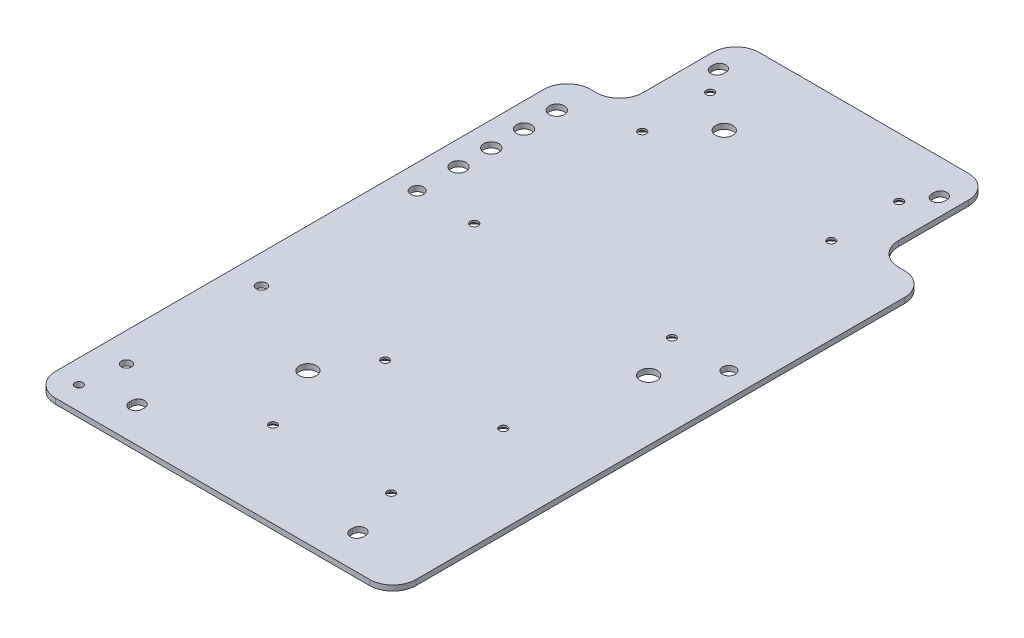
from build123d import *

# Parameters (mm, degrees)
SKETCH1_W                            = 155
SKETCH1_H                            = 280
BOSS_EXTRUDE1_DEPTH                  = 1.143
M5_CLEARANCE_HOLE1_D                 = 5.5
TOP_SIDE_M3_FLAT_HEAD_AT_2_COUNT     = 2
TOP_SIDE_M3_FLAT_HEAD_AT_2_PITCH     = 85
TOP_SIDE_M3_FLAT_HEAD_AT_3_COUNT     = 2
TOP_SIDE_M3_FLAT_HEAD_AT_3_PITCH     = 87.982327771
TOP_SIDE_M3_FLAT_HEAD_AT_4_COUNT     = 2
TOP_SIDE_M3_FLAT_HEAD_AT_4_PITCH     = 118.226435284
TOP_SIDE_M3_FLAT_HEAD_AT_5_COUNT     = 2
TOP_SIDE_M3_FLAT_HEAD_AT_5_PITCH     = 70.044628631
TOP_SIDE_M3_FLAT_HEAD_AT_6_COUNT     = 2
TOP_SIDE_M3_FLAT_HEAD_AT_6_PITCH     = 129.661598016
TOP_SIDE_M3_FLAT_HEAD_AT_7_COUNT     = 2
TOP_SIDE_M3_FLAT_HEAD_AT_7_PITCH     = 129.743653506
TOP_SIDE_M3_FLAT_HEAD_AT_8_COUNT     = 2
TOP_SIDE_M3_FLAT_HEAD_AT_8_PITCH     = 70.419568481
TOP_SIDE_M3_FLAT_HEAD_AT_9_COUNT     = 2
TOP_SIDE_M3_FLAT_HEAD_AT_9_PITCH     = 99.622365084
TOP_SIDE_M3_FLAT_HEAD_AT_10_COUNT    = 2
TOP_SIDE_M3_FLAT_HEAD_AT_10_PITCH    = 108.939045457
ROUTER_M3_MOUNTING_D                 = 7.4
CUT_EXTRUDE1_REACH                   = 162.036
SKETCH10_W                           = 22.5
SKETCH10_H                           = 50
FILLET1_R                            = 10
POWER_TERMINAL_BLOCKS_M2_5_INSERTS_D = 4.4
M3_GROUNDING_WIRE_HOLE_D             = 3.4
CUT_EXTRUDE2_START                   = -2.286
CUT_EXTRUDE2_DEPTH                   = 2.286
CUT_EXTRUDE3_REACH                   = 162.036
SKETCH17_R                           = 3.25


with BuildPart() as part:
    # Sketch1 → Boss-Extrude1 (new, symmetric)
    with BuildSketch(Plane(origin=(0, 0, 0), x_dir=(1, 0, 0), z_dir=(0, 1, 0))):
        Rectangle(SKETCH1_W, SKETCH1_H)
    extrude(amount=BOSS_EXTRUDE1_DEPTH, both=True)

    # M5 Clearance Hole1 (through all)
    with Locations(Plane(origin=(0, 1.143, 0), x_dir=(1, 0, 0), z_dir=(0, 1, 0))):
        with Locations((47.5, -125), (-47.5, 125), (-47.5, -125), (47.5, 125), (67, 15), (-67, 15)):
            Hole(M5_CLEARANCE_HOLE1_D / 2)

    # Sketch7 → Top Side M3 Flat Head (revolve, cut)
    with BuildSketch(Plane(origin=(42.5, -1.143, -15), x_dir=(0, 0, -1), z_dir=(1, 0, 0))):
        Polygon((0, 0), (0, 2.286), (1.7, 2.286), (1.7, 1.45), (3.15, 0), align=None)
    top_side_m3_flat_head = revolve(axis=Axis((42.5, -7.493, -15), (0, 1, 0)), mode=Mode.SUBTRACT)

    # Top Side M3 Flat Head at 2: Top Side M3 Flat Head ×2
    with Locations(*[(-i * TOP_SIDE_M3_FLAT_HEAD_AT_2_PITCH, 0, 0) for i in range(1, TOP_SIDE_M3_FLAT_HEAD_AT_2_COUNT)]):
        add(top_side_m3_flat_head, mode=Mode.SUBTRACT)

    # Top Side M3 Flat Head at 3: Top Side M3 Flat Head ×2
    with Locations(*[Vector(-0.6058034761110396, 0, 0.7956143213465814) * (i * TOP_SIDE_M3_FLAT_HEAD_AT_3_PITCH) for i in range(1, TOP_SIDE_M3_FLAT_HEAD_AT_3_COUNT)]):
        add(top_side_m3_flat_head, mode=Mode.SUBTRACT)

    # Top Side M3 Flat Head at 4: Top Side M3 Flat Head ×2
    with Locations(*[Vector(-0.021145862970418993, 0, 0.9997764012414158) * (i * TOP_SIDE_M3_FLAT_HEAD_AT_4_PITCH) for i in range(1, TOP_SIDE_M3_FLAT_HEAD_AT_4_COUNT)]):
        add(top_side_m3_flat_head, mode=Mode.SUBTRACT)

    # Top Side M3 Flat Head at 5: Top Side M3 Flat Head ×2
    with Locations(*[Vector(-0.035691530512412285, 0, 0.9993628543475496) * (i * TOP_SIDE_M3_FLAT_HEAD_AT_5_PITCH) for i in range(1, TOP_SIDE_M3_FLAT_HEAD_AT_5_COUNT)]):
        add(top_side_m3_flat_head, mode=Mode.SUBTRACT)

    # Top Side M3 Flat Head at 6: Top Side M3 Flat Head ×2
    with Locations(*[Vector(-0.4110700532436934, 0, 0.9116037578499921) * (i * TOP_SIDE_M3_FLAT_HEAD_AT_6_PITCH) for i in range(1, TOP_SIDE_M3_FLAT_HEAD_AT_6_COUNT)]):
        add(top_side_m3_flat_head, mode=Mode.SUBTRACT)

    # Top Side M3 Flat Head at 7: Top Side M3 Flat Head ×2
    with Locations(*[Vector(-0.6408020566213286, 0, -0.7677061444523389) * (i * TOP_SIDE_M3_FLAT_HEAD_AT_7_PITCH) for i in range(1, TOP_SIDE_M3_FLAT_HEAD_AT_7_COUNT)]):
        add(top_side_m3_flat_head, mode=Mode.SUBTRACT)

    # Top Side M3 Flat Head at 8: Top Side M3 Flat Head ×2
    with Locations(*[Vector(-0.026413112720383172, 0, -0.999651112877098) * (i * TOP_SIDE_M3_FLAT_HEAD_AT_8_PITCH) for i in range(1, TOP_SIDE_M3_FLAT_HEAD_AT_8_COUNT)]):
        add(top_side_m3_flat_head, mode=Mode.SUBTRACT)

    # Top Side M3 Flat Head at 9: Top Side M3 Flat Head ×2
    with Locations(*[Vector(-0.01867050635090894, 0, -0.9998256909044699) * (i * TOP_SIDE_M3_FLAT_HEAD_AT_9_PITCH) for i in range(1, TOP_SIDE_M3_FLAT_HEAD_AT_9_COUNT)]):
        add(top_side_m3_flat_head, mode=Mode.SUBTRACT)

    # Top Side M3 Flat Head at 10: Top Side M3 Flat Head ×2
    with Locations(*[Vector(-0.763179075523523, 0, -0.6461870462049366) * (i * TOP_SIDE_M3_FLAT_HEAD_AT_10_PITCH) for i in range(1, TOP_SIDE_M3_FLAT_HEAD_AT_10_COUNT)]):
        add(top_side_m3_flat_head, mode=Mode.SUBTRACT)

    # Router M3 Mounting (through all)
    with Locations(Plane(origin=(0, 1.143, 0), x_dir=(1, 0, 0), z_dir=(0, 1, 0))):
        with Locations((-23.5, -75.5), (-23.5, 103.5), (51.5, -4)):
            Hole(ROUTER_M3_MOUNTING_D / 2)

    # Sketch10 → Cut-Extrude1 (cut, up to next)
    with BuildSketch(Plane(origin=(0, 1.143, 0), x_dir=(1, 0, 0), z_dir=(0, 1, 0)), mode=Mode.PRIVATE) as cut_extrude1_sk1:
        with Locations((-66.25, 115)):
            Rectangle(SKETCH10_W, SKETCH10_H)
    cut_extrude1_tool1 = extrude(cut_extrude1_sk1.sketch, amount=-CUT_EXTRUDE1_REACH, mode=Mode.PRIVATE) & part.part
    # Sketch10 → Cut-Extrude1 (cut, up to next)
    with BuildSketch(Plane(origin=(0, 1.143, 0), x_dir=(1, 0, 0), z_dir=(0, 1, 0)), mode=Mode.PRIVATE) as cut_extrude1_sk2:
        with Locations((66.25, 115)):
            Rectangle(SKETCH10_W, SKETCH10_H)
    cut_extrude1_tool2 = extrude(cut_extrude1_sk2.sketch, amount=-CUT_EXTRUDE1_REACH, mode=Mode.PRIVATE) & part.part
    add(cut_extrude1_tool1.solids().sort_by_distance((-66.25, 1.143, -115))[0], mode=Mode.SUBTRACT)
    add(cut_extrude1_tool2.solids().sort_by_distance((66.25, 1.143, -115))[0], mode=Mode.SUBTRACT)

    # Fillet1
    fillet1_edges = [part.edges().sort_by_distance(p)[0] for p in [
        (-77.5, 0, -90),
        (-55, 0, -140),
        (-55, 0, -90),
        (77.5, 0, -90),
        (55, 0, -90),
        (55, 0, -140),
        (77.5, 0, 140),
        (-77.5, 0, 140),
    ]]
    fillet(fillet1_edges, radius=FILLET1_R)

    # Power Terminal Blocks M2.5 Inserts (through all)
    with Locations(Plane(origin=(0, 1.143, 0), x_dir=(1, 0, 0), z_dir=(0, 1, 0))):
        with Locations((-65, -112), (-65, -54)):
            Hole(POWER_TERMINAL_BLOCKS_M2_5_INSERTS_D / 2)

    # M3 grounding wire hole (through all)
    with Locations(Plane(origin=(0, 1.143, 0), x_dir=(1, 0, 0), z_dir=(0, 1, 0))):
        with Locations((-67.5, -130)):
            Hole(M3_GROUNDING_WIRE_HOLE_D / 2)

    # Sketch15 → Cut-Extrude2 (cut)
    with BuildSketch(Plane(origin=(0, 1.143, 0), x_dir=(1, 0, 0), z_dir=(0, 1, 0)).offset(CUT_EXTRUDE2_START)):
        with BuildLine():
            Line((44.75, 124.5), (44.75, 125.5))
            ThreePointArc((44.75, 125.5), (47.5, 128.25), (50.25, 125.5))
            Line((50.25, 125.5), (50.25, 124.5))
            ThreePointArc((50.25, 124.5), (47.5, 121.75), (44.75, 124.5))
        make_face()
        with BuildLine():
            Line((-44.75, 125.5), (-44.75, 124.5))
            ThreePointArc((-44.75, 124.5), (-47.5, 121.75), (-50.25, 124.5))
            Line((-50.25, 124.5), (-50.25, 125.5))
            ThreePointArc((-50.25, 125.5), (-47.5, 128.25), (-44.75, 125.5))
        make_face()
        with BuildLine():
            Line((-44.75, -124.5), (-44.75, -125.5))
            ThreePointArc((-44.75, -125.5), (-47.5, -128.25), (-50.25, -125.5))
            Line((-50.25, -125.5), (-50.25, -124.5))
            ThreePointArc((-50.25, -124.5), (-47.5, -121.75), (-44.75, -124.5))
        make_face()
        with BuildLine():
            Line((50.25, -124.5), (50.25, -125.5))
            ThreePointArc((50.25, -125.5), (47.5, -128.25), (44.75, -125.5))
            Line((44.75, -125.5), (44.75, -124.5))
            ThreePointArc((44.75, -124.5), (47.5, -121.75), (50.25, -124.5))
        make_face()
    extrude(amount=CUT_EXTRUDE2_DEPTH, mode=Mode.SUBTRACT)

    # Sketch17 → Cut-Extrude3 (cut, up to next)
    with BuildSketch(Plane(origin=(0, 1.143, 0), x_dir=(1, 0, 0), z_dir=(0, 1, 0)), mode=Mode.PRIVATE) as cut_extrude3_sk1:
        with Locations(Location((-67, 32.75, 0), (0, 0, 270))):
            Circle(SKETCH17_R)
    cut_extrude3_tool1 = extrude(cut_extrude3_sk1.sketch, amount=-CUT_EXTRUDE3_REACH, mode=Mode.PRIVATE) & part.part
    # Sketch17 → Cut-Extrude3 (cut, up to next)
    with BuildSketch(Plane(origin=(0, 1.143, 0), x_dir=(1, 0, 0), z_dir=(0, 1, 0)), mode=Mode.PRIVATE) as cut_extrude3_sk2:
        with Locations(Location((-67, 46.833333333, 0), (0, 0, 270))):
            Circle(SKETCH17_R)
    cut_extrude3_tool2 = extrude(cut_extrude3_sk2.sketch, amount=-CUT_EXTRUDE3_REACH, mode=Mode.PRIVATE) & part.part
    # Sketch17 → Cut-Extrude3 (cut, up to next)
    with BuildSketch(Plane(origin=(0, 1.143, 0), x_dir=(1, 0, 0), z_dir=(0, 1, 0)), mode=Mode.PRIVATE) as cut_extrude3_sk3:
        with Locations(Location((-67, 60.916666667, 0), (0, 0, 270))):
            Circle(SKETCH17_R)
    cut_extrude3_tool3 = extrude(cut_extrude3_sk3.sketch, amount=-CUT_EXTRUDE3_REACH, mode=Mode.PRIVATE) & part.part
    # Sketch17 → Cut-Extrude3 (cut, up to next)
    with BuildSketch(Plane(origin=(0, 1.143, 0), x_dir=(1, 0, 0), z_dir=(0, 1, 0)), mode=Mode.PRIVATE) as cut_extrude3_sk4:
        with Locations(Location((-67, 75, 0), (0, 0, 270))):
            Circle(SKETCH17_R)
    cut_extrude3_tool4 = extrude(cut_extrude3_sk4.sketch, amount=-CUT_EXTRUDE3_REACH, mode=Mode.PRIVATE) & part.part
    add(cut_extrude3_tool1.solids().sort_by_distance((-67, 1.143, -32.75))[0], mode=Mode.SUBTRACT)
    add(cut_extrude3_tool2.solids().sort_by_distance((-67, 1.143, -46.833333))[0], mode=Mode.SUBTRACT)
    add(cut_extrude3_tool3.solids().sort_by_distance((-67, 1.143, -60.916667))[0], mode=Mode.SUBTRACT)
    add(cut_extrude3_tool4.solids().sort_by_distance((-67, 1.143, -75))[0], mode=Mode.SUBTRACT)


solid = part.part
